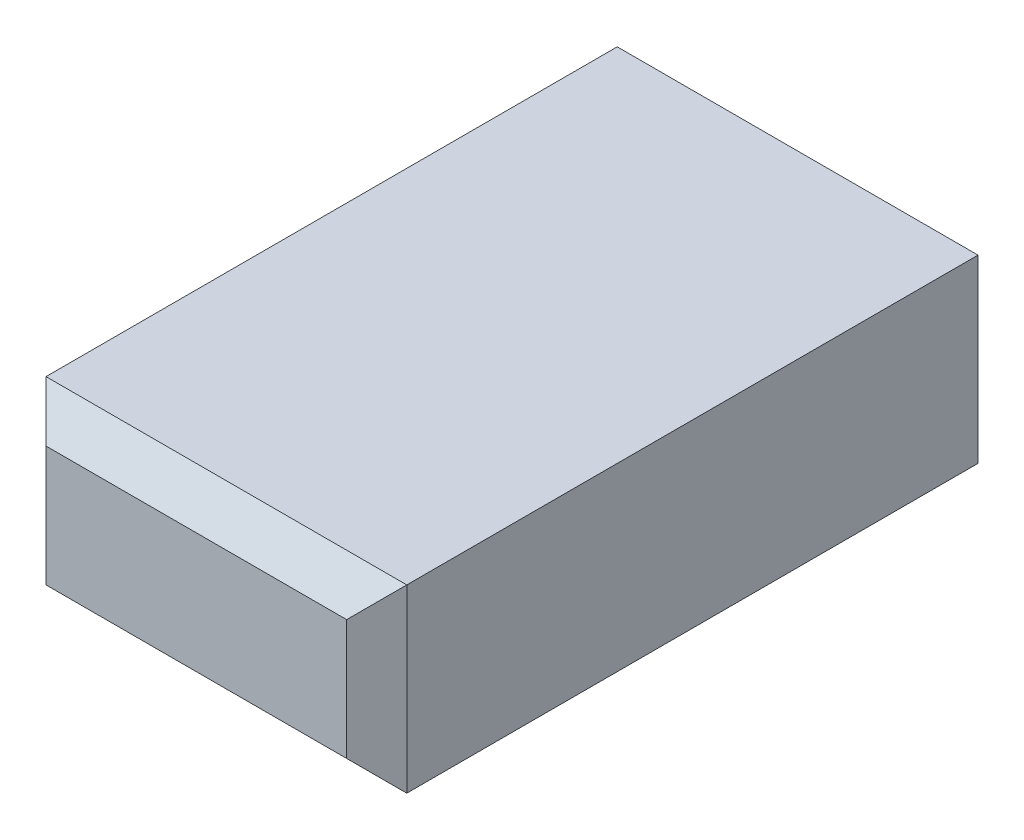
from build123d import *

# Parameters (mm, degrees)
ESQUISSE1_W        = 6
ESQUISSE1_H        = 3
BOSS_EXTRU_1_DEPTH = 10
CHANFREIN1_SIZE    = 0.5


with BuildPart() as part:
    # Esquisse1 → Boss.-Extru.1 (new body)
    with BuildSketch(Plane.XY):
        Rectangle(ESQUISSE1_W, ESQUISSE1_H)
    extrude(amount=BOSS_EXTRU_1_DEPTH)

    # Chanfrein1
    chanfrein1_edges = [part.edges().sort_by_distance(p)[0] for p in [
        (3, 0, 10),
        (0, 1.5, 10),
        (-3, 0, 10),
        (0, -1.5, 10),
    ]]
    chamfer(chanfrein1_edges, length=CHANFREIN1_SIZE)


solid = part.part
